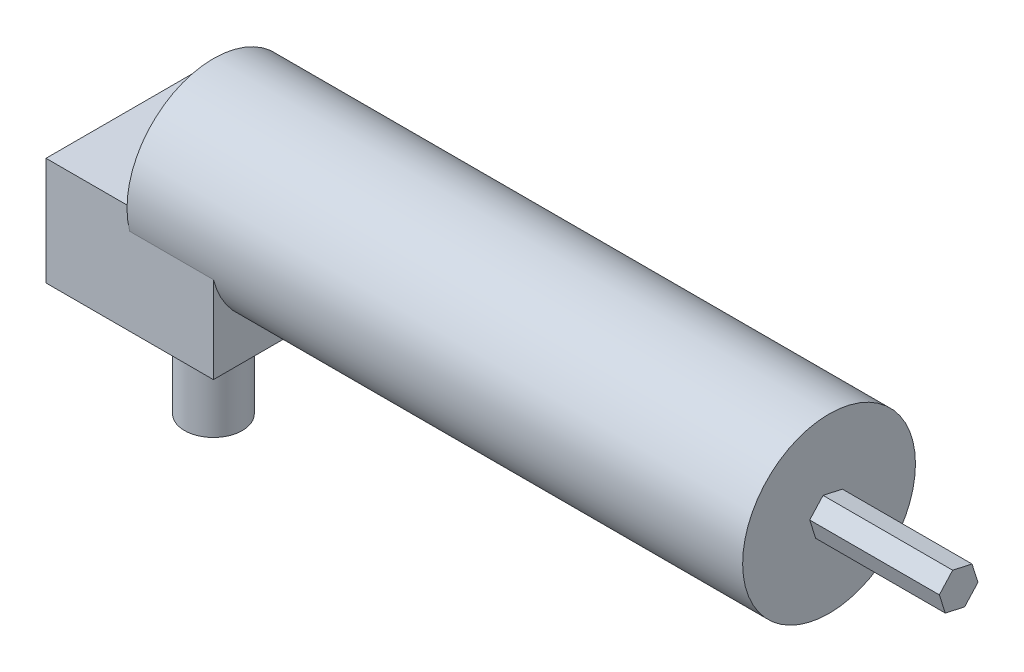
from build123d import *

# Parameters (mm, degrees)
SKETCH1_W           = 31
SKETCH1_H           = 31
BOSS_EXTRUDE1_DEPTH = 20
SKETCH2_R           = 16
BOSS_EXTRUDE2_DEPTH = 114
BOSS_EXTRUDE3_DEPTH = 24
SKETCH4_R           = 5.35
BOSS_EXTRUDE4_DEPTH = 21
CUT_EXTRUDE1_DEPTH  = 7.41


with BuildPart() as part:
    # Sketch1 → Boss-Extrude1 (new body)
    with BuildSketch(Plane(origin=(0, 0, 0), x_dir=(1, 0, 0), z_dir=(0, 1, 0))):
        Rectangle(SKETCH1_W, SKETCH1_H)
    extrude(amount=BOSS_EXTRUDE1_DEPTH)

    # Sketch2 → Boss-Extrude2 (add)
    with BuildSketch(Plane(origin=(0, 0, 0), x_dir=(0, 0, -1), z_dir=(1, 0, 0))):
        with Locations(Location((0, 20, 0), (0, 0, 194.361511563))):
            Circle(SKETCH2_R)
    extrude(amount=BOSS_EXTRUDE2_DEPTH)

    # Sketch3 → Boss-Extrude3 (add)
    with BuildSketch(Plane(origin=(114, 0, 0), x_dir=(0, 0, -1), z_dir=(1, 0, 0))):
        Polygon((2.469779477, 22.709432167), (-1.111547348, 23.493607852), (-3.581326825, 20.784175685), (-2.469779477, 17.290567833), (1.111547348, 16.506392148), (3.581326825, 19.215824315), align=None)
    extrude(amount=BOSS_EXTRUDE3_DEPTH)

    # Sketch4 → Boss-Extrude4 (add)
    with BuildSketch(Plane.XZ):
        with Locations(Location((0, 0, 0), (0, 0, 90))):
            Circle(SKETCH4_R)
    extrude(amount=BOSS_EXTRUDE4_DEPTH)

    # Sketch5 → Cut-Extrude1 (cut)
    with BuildSketch(Plane.XZ.offset(21)):
        Polygon((-3.948474252, -0.861907427), (-1.227803399, -3.850432722), (2.720670854, -2.988525295), (3.948474252, 0.861907427), (1.227803399, 3.850432722), (-2.720670854, 2.988525295), align=None)
    extrude(amount=-CUT_EXTRUDE1_DEPTH, mode=Mode.SUBTRACT)


solid = part.part
